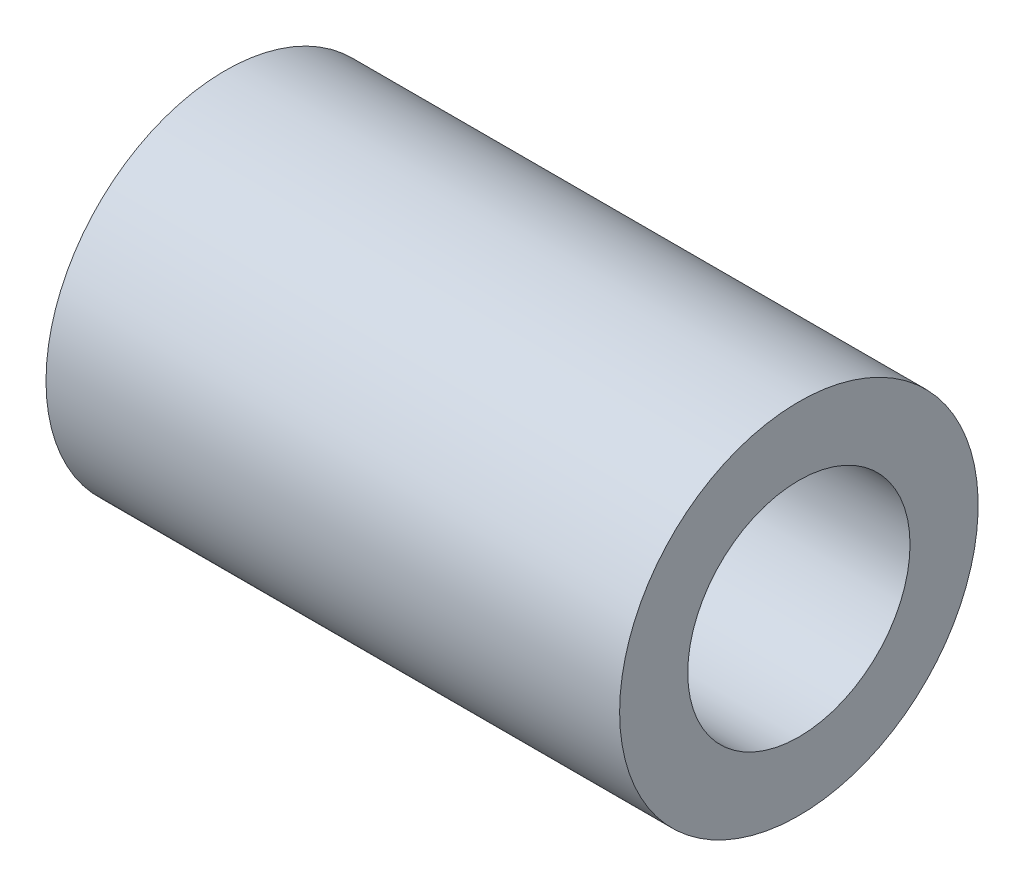
from build123d import *

# Parameters (mm, degrees)
SKETCH1_W = 16
SKETCH1_H = 1.9


with BuildPart() as part:
    # Sketch1 → Revolve1 (revolve)
    with BuildSketch(Plane.XY, mode=Mode.PRIVATE) as revolve1_sk:
        with Locations((8, 4.05)):
            Rectangle(SKETCH1_W, SKETCH1_H)
    revolve(revolve1_sk.sketch.rotate(Axis((0, 0, 0), (1, 0, 0)), 90), axis=Axis((0, 0, 0), (1, 0, 0)))


solid = part.part
